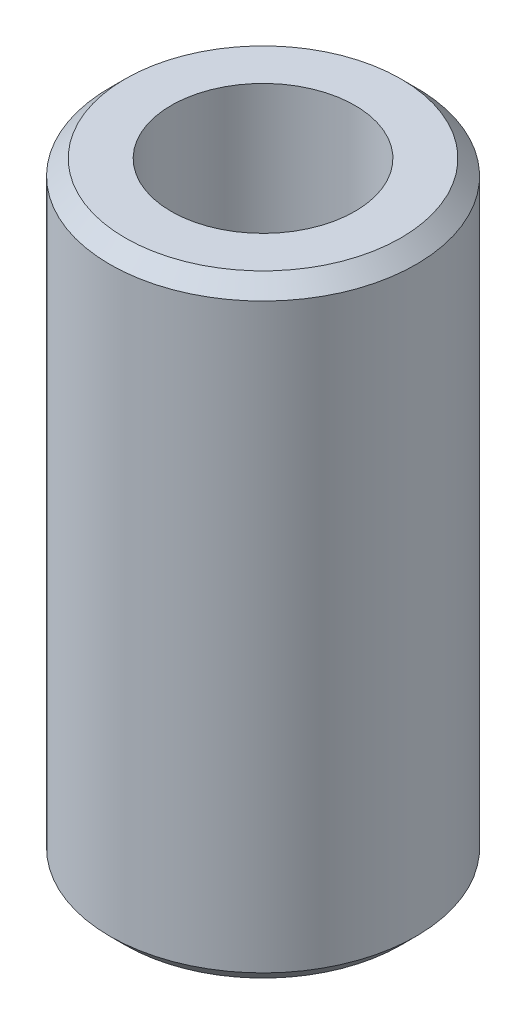
from build123d import *

# Parameters (mm, degrees)
SKETCH1_R           = 5
SKETCH1_R_2         = 3
BOSS_EXTRUDE1_DEPTH = 10
CHAMFER1_SIZE       = 0.5


with BuildPart() as part:
    # Sketch1 → Boss-Extrude1 (new, symmetric)
    with BuildSketch(Plane(origin=(0, 0, 0), x_dir=(1, 0, 0), z_dir=(0, 1, 0))):
        with Locations(Location((0, 0, 0), (0, 0, 270))):
            Circle(SKETCH1_R)
        with Locations(Location((0, 0, 0), (0, 0, 270))):
            Circle(SKETCH1_R_2, mode=Mode.SUBTRACT)
    extrude(amount=BOSS_EXTRUDE1_DEPTH, both=True)

    # Chamfer1
    chamfer1_edges = [part.edges().sort_by_distance(p)[0] for p in [
        (0, -10, -5),
        (0, 10, -5),
    ]]
    chamfer(chamfer1_edges, length=CHAMFER1_SIZE)


solid = part.part
